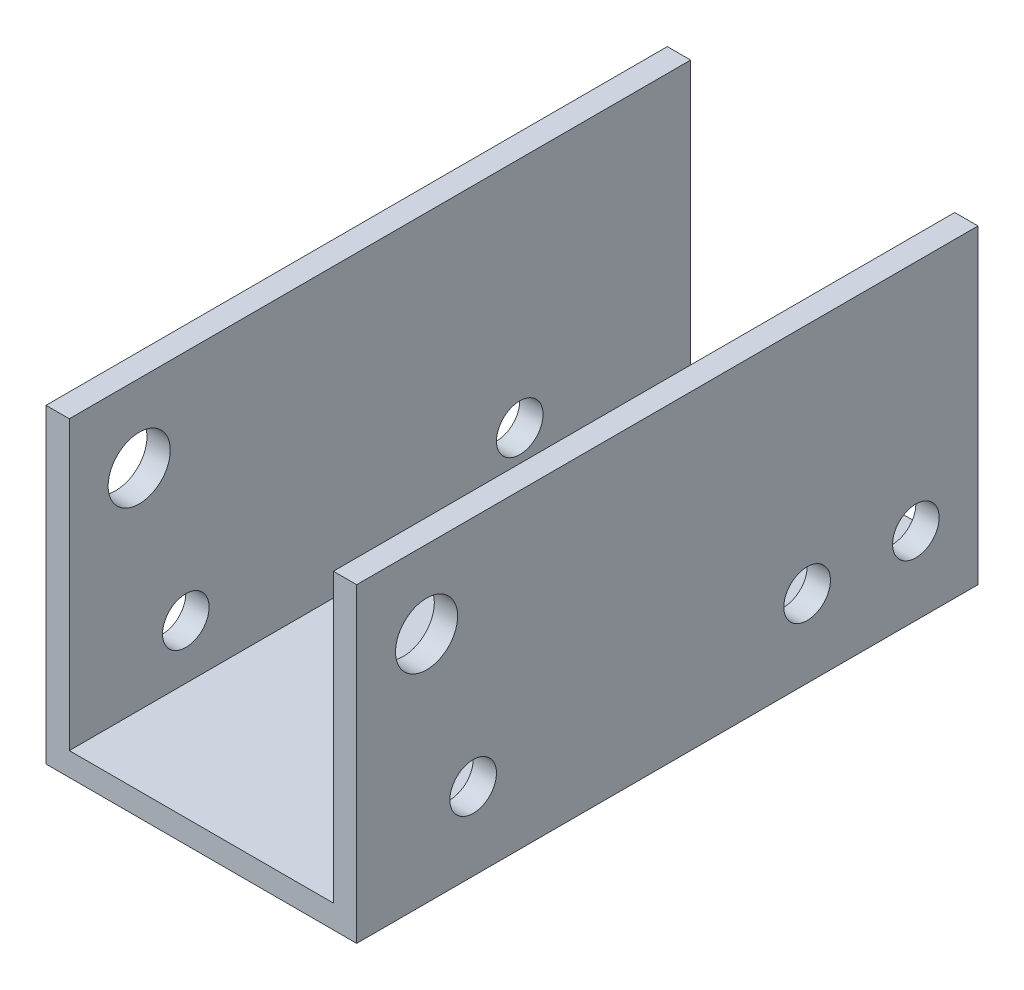
from build123d import *

# Parameters (mm, degrees)
EXTRUSION1_DEPTH = 40
ESQUISSE2_R      = 1.5
ESQUISSE2_R_2    = 2
EXTRUSION2_DEPTH = 49.396797415
ESQUISSE3_R      = 1.5
EXTRUSION3_DEPTH = 6


with BuildPart() as part:
    # Esquisse1 → Extrusion1 (new body)
    with BuildSketch(Plane.XY):
        Polygon((-8.904835854, 18.5), (-8.904835854, -1.5), (11.095164146, -1.5), (11.095164146, 18.5), (9.595164146, 18.5), (9.595164146, 0), (-7.404835854, 0), (-7.404835854, 18.5), align=None)
    extrude(amount=EXTRUSION1_DEPTH)

    # Esquisse2 → Extrusion2 (cut, through all)
    with BuildSketch(Plane(origin=(11.095164146, 0, 0), x_dir=(0, 0, -1), z_dir=(1, 0, 0))):
        with Locations((-32.5, 3.5)):
            Circle(ESQUISSE2_R)
        with Locations((-11, 3.5)):
            Circle(ESQUISSE2_R)
        with Locations((-35.5, 13.5)):
            Circle(ESQUISSE2_R_2)
    extrude(amount=-EXTRUSION2_DEPTH, mode=Mode.SUBTRACT)

    # Esquisse3 → Extrusion3 (cut)
    with BuildSketch(Plane(origin=(11.095164146, 0, 0), x_dir=(0, 0, -1), z_dir=(1, 0, 0))):
        with Locations((-4, 3.5)):
            Circle(ESQUISSE3_R)
    extrude(amount=-EXTRUSION3_DEPTH, mode=Mode.SUBTRACT)


solid = part.part
